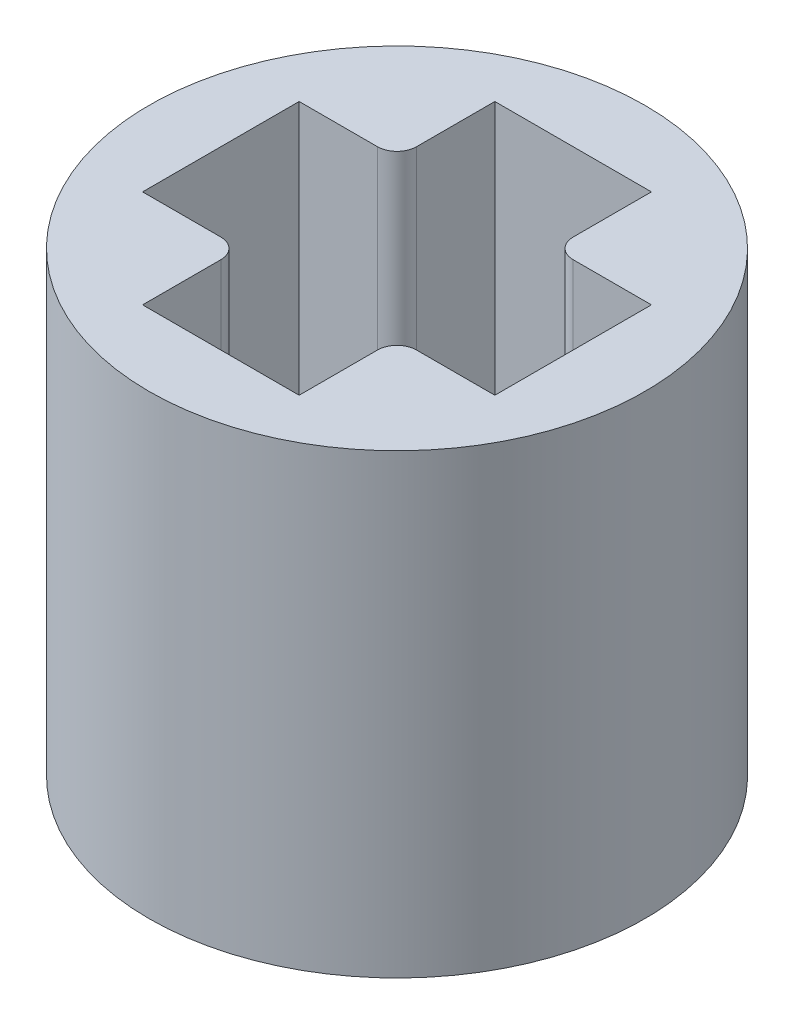
from build123d import *

# Parameters (mm, degrees)
SKETCH1_R           = 3.8
BOSS_EXTRUDE1_DEPTH = 7


with BuildPart() as part:
    # Sketch1 → Boss-Extrude1 (new body)
    with BuildSketch(Plane(origin=(0, 0, 0), x_dir=(1, 0, 0), z_dir=(0, 1, 0))):
        with Locations(Location((0, 0, 0), (0, 0, 270))):
            Circle(SKETCH1_R)
        with BuildLine():
            Line((1.5, -1.2), (2.7, -1.2))
            Line((2.7, -1.2), (2.7, 1.2))
            Line((2.7, 1.2), (1.5, 1.2))
            ThreePointArc((1.5, 1.2), (1.287867966, 1.287867966), (1.2, 1.5))
            Line((1.2, 1.5), (1.2, 2.7))
            Line((1.2, 2.7), (-1.2, 2.7))
            Line((-1.2, 2.7), (-1.2, 1.5))
            ThreePointArc((-1.2, 1.5), (-1.287867966, 1.287867966), (-1.5, 1.2))
            Line((-1.5, 1.2), (-2.7, 1.2))
            Line((-2.7, 1.2), (-2.7, -1.2))
            Line((-2.7, -1.2), (-1.5, -1.2))
            ThreePointArc((-1.5, -1.2), (-1.287867966, -1.287867966), (-1.2, -1.5))
            Line((-1.2, -1.5), (-1.2, -2.7))
            Line((-1.2, -2.7), (1.2, -2.7))
            Line((1.2, -2.7), (1.2, -1.5))
            ThreePointArc((1.2, -1.5), (1.287867966, -1.287867966), (1.5, -1.2))
        make_face(mode=Mode.SUBTRACT)
    extrude(amount=BOSS_EXTRUDE1_DEPTH)


solid = part.part
